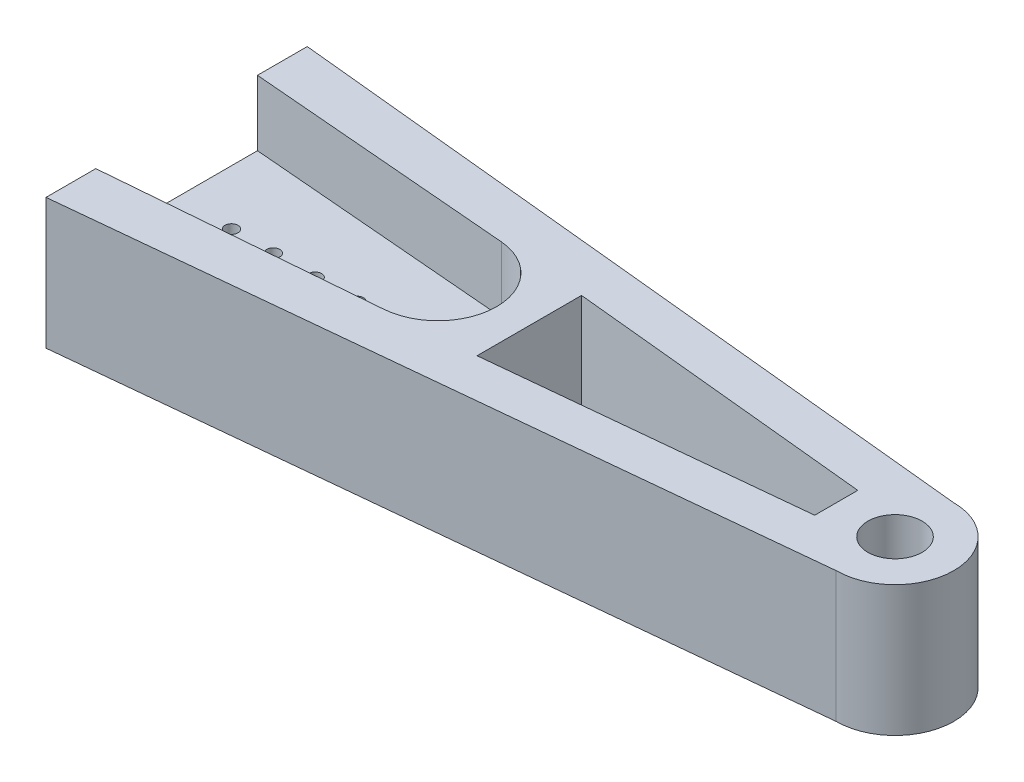
from build123d import *

# Parameters (mm, degrees)
SKETCH1_R               = 2.075
BOSS_EXTRUDE1_DEPTH     = 5
BOSS_EXTRUDE4_START     = -5
SKETCH4_R               = 0.5
SKETCH4_R_2             = 2.1
BOSS_EXTRUDE4_DEPTH     = 5
CUT_EXTRUDE1_DEPTH      = 5
CUT_EXTRUDE1_DEPTH_BACK = 5


with BuildPart() as part:
    # Sketch1 → Boss-Extrude1 (new body)
    with BuildSketch(Plane(origin=(0, 0, 0), x_dir=(1, 0, 0), z_dir=(0, 1, 0))):
        with BuildLine():
            Line((65, 4.5), (10, 10))
            Line((10, 10), (10, 6.188190874))
            Line((10, 6.188190874), (30.375, 4.484347779))
            ThreePointArc((30.375, 4.484347779), (34.5, 0), (30.375, -4.484347779))
            Line((30.375, -4.484347779), (10, -6.188190874))
            Line((10, -6.188190874), (10, -10))
            Line((10, -10), (65, -4.5))
            ThreePointArc((65, -4.5), (69.5, 0), (65, 4.5))
        make_face()
        with Locations((65, 0)):
            Circle(SKETCH1_R, mode=Mode.SUBTRACT)
    extrude(amount=BOSS_EXTRUDE1_DEPTH)

    # Sketch4 → Boss-Extrude4 (add)
    with BuildSketch(Plane(origin=(0, 0, 0), x_dir=(1, 0, 0), z_dir=(0, 1, 0)).offset(BOSS_EXTRUDE4_START)):
        with BuildLine():
            Line((10, 10), (10, -10))
            Line((10, -10), (65, -4.5))
            ThreePointArc((65, -4.5), (69.5, 0), (65, 4.5))
            Line((65, 4.5), (10, 10))
        make_face()
        with Locations((14.2, 0)):
            Circle(SKETCH4_R, mode=Mode.SUBTRACT)
        with Locations((17.4, 0)):
            Circle(SKETCH4_R, mode=Mode.SUBTRACT)
        with Locations((20.6, 0)):
            Circle(SKETCH4_R, mode=Mode.SUBTRACT)
        with Locations((23.8, 0)):
            Circle(SKETCH4_R, mode=Mode.SUBTRACT)
        with Locations((27, 0)):
            Circle(SKETCH4_R, mode=Mode.SUBTRACT)
        with Locations((30.2, 0)):
            Circle(SKETCH4_R, mode=Mode.SUBTRACT)
        with Locations((65, 0)):
            Circle(SKETCH4_R_2, mode=Mode.SUBTRACT)
    extrude(amount=BOSS_EXTRUDE4_DEPTH)

    # Sketch3 → Cut-Extrude1 (cut, two sides: drawn at the far end of the back side and taken through both)
    with BuildSketch(Plane(origin=(0, 0, 0), x_dir=(1, 0, 0), z_dir=(0, 1, 0)).offset(-CUT_EXTRUDE1_DEPTH_BACK)):
        Polygon((60.5, -1.65), (60.5, 1.65), (37, 4), (37, -4), align=None)
    extrude(amount=CUT_EXTRUDE1_DEPTH + CUT_EXTRUDE1_DEPTH_BACK, mode=Mode.SUBTRACT)


solid = part.part
